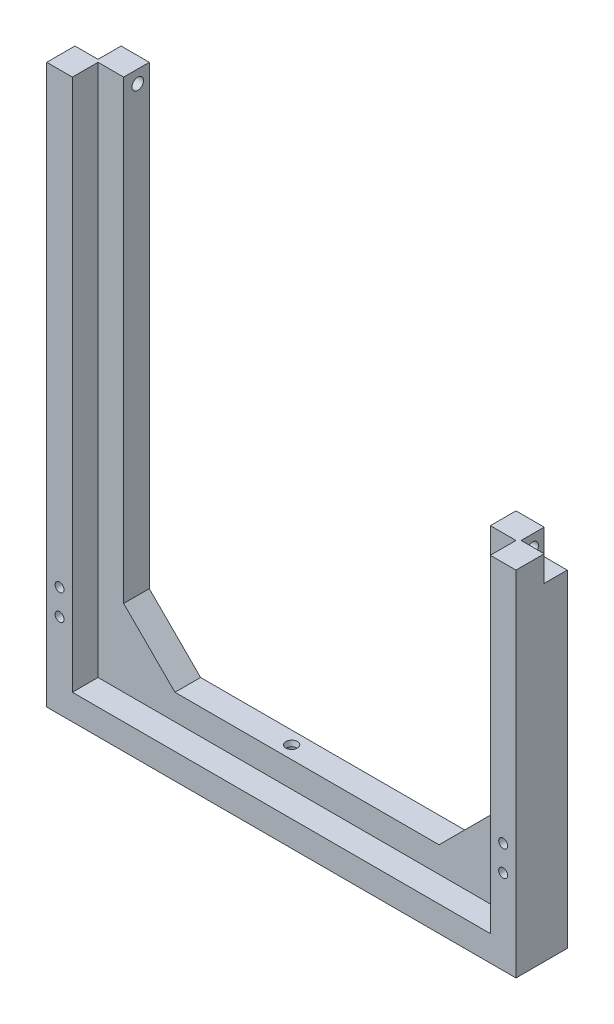
from build123d import *

# Parameters (mm, degrees)
BOSS_EXTRUDE1_DEPTH = 10
BOSS_EXTRUDE2_DEPTH = 10
SKETCH3_W           = 9
SKETCH3_H           = 9
CUT_EXTRUDE2_DEPTH  = 10
SKETCH5_W           = 9
SKETCH5_H           = 9
CUT_EXTRUDE3_DEPTH  = 10
SKETCH6_R           = 2.25
CUT_EXTRUDE4_DEPTH  = 11
SKETCH7_R           = 2.25
CUT_EXTRUDE5_DEPTH  = 11
SKETCH8_R           = 1.75
CUT_EXTRUDE6_DEPTH  = 238.06159669
SKETCH9_R           = 1.75
CUT_EXTRUDE7_DEPTH  = 6
CHAMFER1_SIZE       = 0.5
CHAMFER1_SIZE2      = 1.866025404
CUT_EXTRUDE8_DEPTH  = 2.1


with BuildPart() as part:
    # Sketch1 → Boss-Extrude1 (new body)
    with BuildSketch(Plane.XY):
        Polygon((0, 0), (-91.5, 0), (-91.5, 217.775), (-71.5, 217.775), (-71.5, 40), (-51.5, 20), (0, 20), (51.5, 20), (71.5, 40), (71.5, 137.775), (91.5, 137.775), (91.5, 0), align=None)
    extrude(amount=BOSS_EXTRUDE1_DEPTH)

    # Sketch2 → Boss-Extrude2 (add)
    with BuildSketch(Plane.XY.offset(10)):
        Polygon((-81.5, 217.775), (-91.5, 217.775), (-91.5, 0), (91.5, 0), (91.5, 137.775), (81.5, 137.775), (81.5, 10), (-81.5, 10), align=None)
    extrude(amount=BOSS_EXTRUDE2_DEPTH)

    # Sketch3 → Cut-Extrude2 (cut)
    with BuildSketch(Plane(origin=(0, 217.775, 0), x_dir=(1, 0, 0), z_dir=(0, 1, 0))):
        with Locations((-87, -4.5)):
            Rectangle(SKETCH3_W, SKETCH3_H)
    extrude(amount=-CUT_EXTRUDE2_DEPTH, mode=Mode.SUBTRACT)

    # Sketch5 → Cut-Extrude3 (cut)
    with BuildSketch(Plane(origin=(0, 137.775, 0), x_dir=(1, 0, 0), z_dir=(0, 1, 0))):
        with Locations((87, -4.5)):
            Rectangle(SKETCH5_W, SKETCH5_H)
    extrude(amount=-CUT_EXTRUDE3_DEPTH, mode=Mode.SUBTRACT)

    # Sketch6 → Cut-Extrude4 (cut)
    with BuildSketch(Plane.ZY.offset(82.5)):
        with Locations((4.5, 212.775)):
            Circle(SKETCH6_R)
    extrude(amount=-CUT_EXTRUDE4_DEPTH, mode=Mode.SUBTRACT)

    # Sketch7 → Cut-Extrude5 (cut)
    with BuildSketch(Plane(origin=(82.5, 0, 0), x_dir=(0, 0, -1), z_dir=(1, 0, 0))):
        with Locations((-4.5, 132.775)):
            Circle(SKETCH7_R)
    extrude(amount=-CUT_EXTRUDE5_DEPTH, mode=Mode.SUBTRACT)

    # Sketch8 → Cut-Extrude6 (cut, through all)
    with BuildSketch(Plane(origin=(0, 0, 0), x_dir=(-1, 0, 0), z_dir=(0, 0, -1))):
        with Locations((86.5, 33)):
            Circle(SKETCH8_R)
        with Locations((-86.5, 33)):
            Circle(SKETCH8_R)
        with Locations((-86.5, 43)):
            Circle(SKETCH8_R)
        with Locations((86.5, 43)):
            Circle(SKETCH8_R)
    extrude(amount=-CUT_EXTRUDE6_DEPTH, mode=Mode.SUBTRACT)

    # Sketch9 → Cut-Extrude7 (cut)
    with BuildSketch(Plane(origin=(0, 20, 0), x_dir=(1, 0, 0), z_dir=(0, 1, 0))):
        with Locations(Location((-11, -5, 0), (0, 0, 270))):
            Circle(SKETCH9_R)
    extrude(amount=-CUT_EXTRUDE7_DEPTH, mode=Mode.SUBTRACT)

    # Chamfer1
    chamfer1_edges = [part.edges().sort_by_distance(p)[0] for p in [
        (-11, 20, 3.25),
    ]]
    chamfer1_side = [part.faces().sort_by_distance(p)[0] for p in [
        (0.103718732, 20, 5),
    ]]
    chamfer(chamfer1_edges, length=CHAMFER1_SIZE, length2=CHAMFER1_SIZE2, reference=chamfer1_side[0])

    # Sketch10 → Cut-Extrude8 (cut)
    with BuildSketch(Plane(origin=(0, 0, 0), x_dir=(-1, 0, 0), z_dir=(0, 0, -1))):
        Polygon((-84.854551733, 30.15), (-83.209103466, 33), (-84.854551733, 35.85), (-88.145448267, 35.85), (-89.790896534, 33), (-88.145448267, 30.15), align=None)
        Polygon((88.145448267, 30.15), (89.790896534, 33), (88.145448267, 35.85), (84.854551733, 35.85), (83.209103466, 33), (84.854551733, 30.15), align=None)
        Polygon((-84.854551733, 40.15), (-83.209103466, 43), (-84.854551733, 45.85), (-88.145448267, 45.85), (-89.790896534, 43), (-88.145448267, 40.15), align=None)
        Polygon((88.145448267, 40.15), (89.790896534, 43), (88.145448267, 45.85), (84.854551733, 45.85), (83.209103466, 43), (84.854551733, 40.15), align=None)
    extrude(amount=-CUT_EXTRUDE8_DEPTH, mode=Mode.SUBTRACT)


solid = part.part
